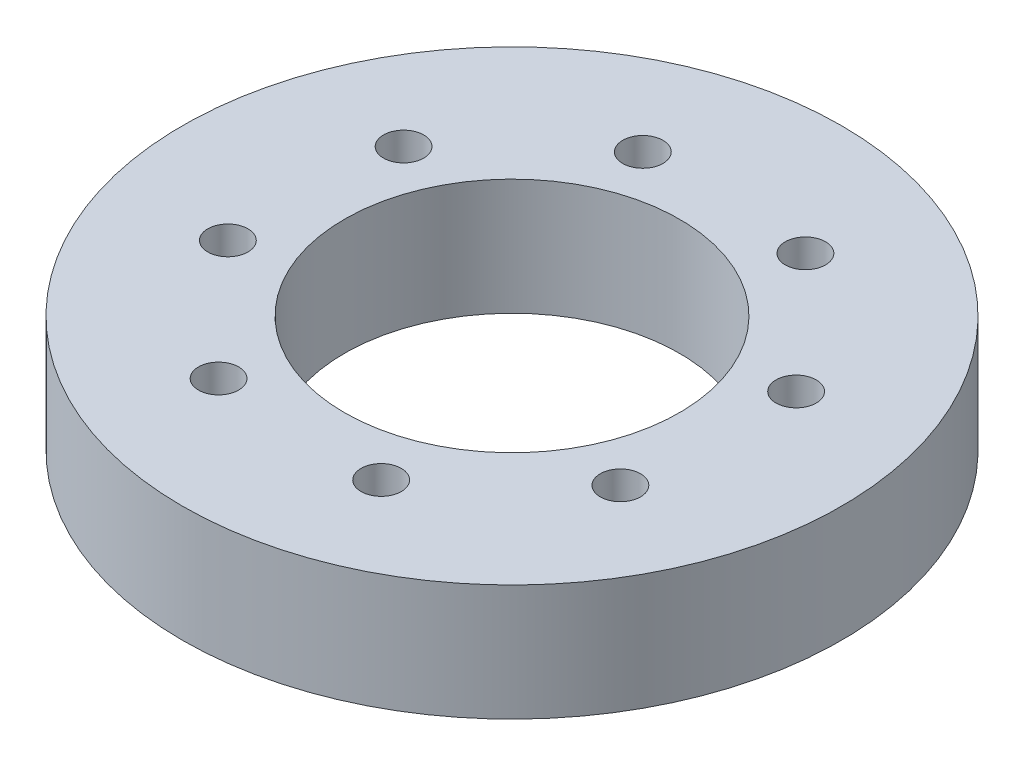
from build123d import *

# Parameters (mm, degrees)
SKETCH_1_R               = 14.75
SKETCH_1_R_2             = 7.5
EXTRUDE_1_DEPTH          = 5.2
SKETCH_2_R               = 0.9
CUT_EXTRUDE_1_DEPTH      = 25.266952837
PATTERN_CIRCULAR_1_COUNT = 8


with BuildPart() as part:
    # 草图1 → 凸台-拉伸1 (new body)
    with BuildSketch(Plane(origin=(0, 0, 0), x_dir=(1, 0, 0), z_dir=(0, 1, 0))):
        with Locations(Location((0, 0, 0), (0, 0, 270))):
            Circle(SKETCH_1_R)
        with Locations(Location((0, 0, 0), (0, 0, 270))):
            Circle(SKETCH_1_R_2, mode=Mode.SUBTRACT)
    extrude(amount=EXTRUDE_1_DEPTH)

    # 草图2 → 切除-拉伸1 (cut, through all)
    with BuildSketch(Plane.XZ.offset(7.2)):
        with Locations(Location((9.28608339, -3.430547373, 0), (0, 0, 270))):
            Circle(SKETCH_2_R)
    cut_extrude_1 = extrude(amount=-CUT_EXTRUDE_1_DEPTH, mode=Mode.SUBTRACT)

    # 阵列(圆周)1: 切除-拉伸1 ×8 about axis
    pattern_circular_1_axis = Axis((0, 0, 0), (0, 1, 0))
    for i in range(1, PATTERN_CIRCULAR_1_COUNT):
        add(cut_extrude_1.rotate(pattern_circular_1_axis, i * 360 / PATTERN_CIRCULAR_1_COUNT), mode=Mode.SUBTRACT)


solid = part.part
